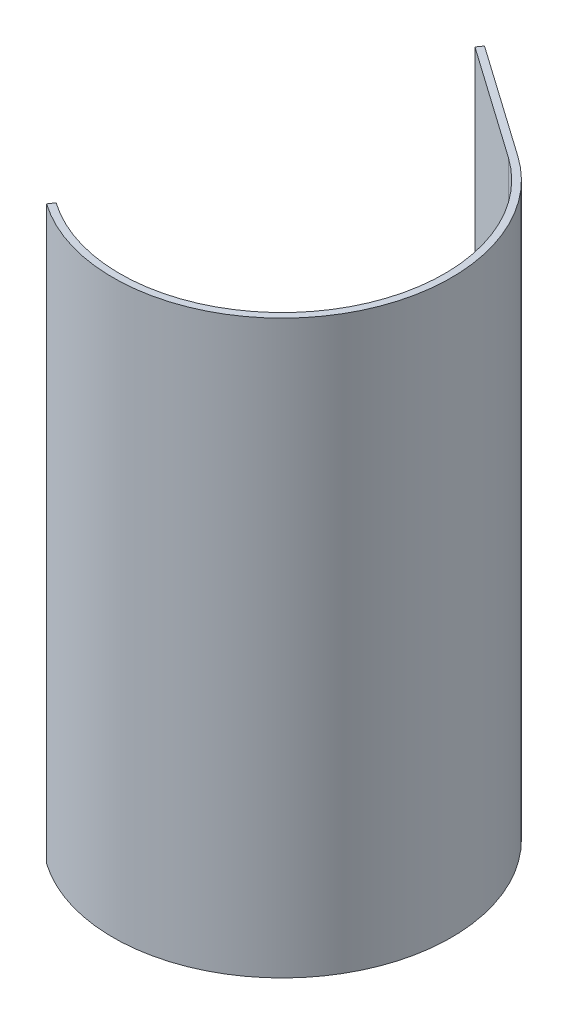
from build123d import *

# Parameters (mm, degrees)
BOSS_EXTRU_1_DEPTH = 250
ESQUISSE7_W        = 3
ESQUISSE7_H        = 250
BOSS_EXTRU_4_DEPTH = 60


with BuildPart() as part:
    # Esquisse1 → Boss.-Extru.1 (new body)
    with BuildSketch(Plane(origin=(0, 0, 0), x_dir=(1, 0, 0), z_dir=(0, 1, 0))):
        with BuildLine():
            ThreePointArc((74, 0), (65.667169842, 34.11484728), (42.545329596, 60.546634337))
            Line((42.545329596, 60.546634337), (40.820518937, 58.092041053))
            ThreePointArc((40.820518937, 58.092041053), (63.004987281, 32.731812931), (71, 0))
            ThreePointArc((71, 0), (32.731812931, -63.004987281), (-40.820518937, -58.092041053))
            Line((-40.820518937, -58.092041053), (-42.545329596, -60.546634337))
            ThreePointArc((-42.545329596, -60.546634337), (34.11484728, -65.667169842), (74, 0))
        make_face()
    extrude(amount=BOSS_EXTRU_1_DEPTH)

    # Esquisse7 → Boss.-Extru.4 (add)
    with BuildSketch(Plane(origin=(0, 0, 0), x_dir=(-0.5749368864324517, 0, 0.8181977613140713), z_dir=(-0.8181977613140715, 0, -0.5749368864324517))):
        with Locations((-72.5, 125)):
            Rectangle(ESQUISSE7_W, ESQUISSE7_H)
    extrude(amount=BOSS_EXTRU_4_DEPTH)


solid = part.part
